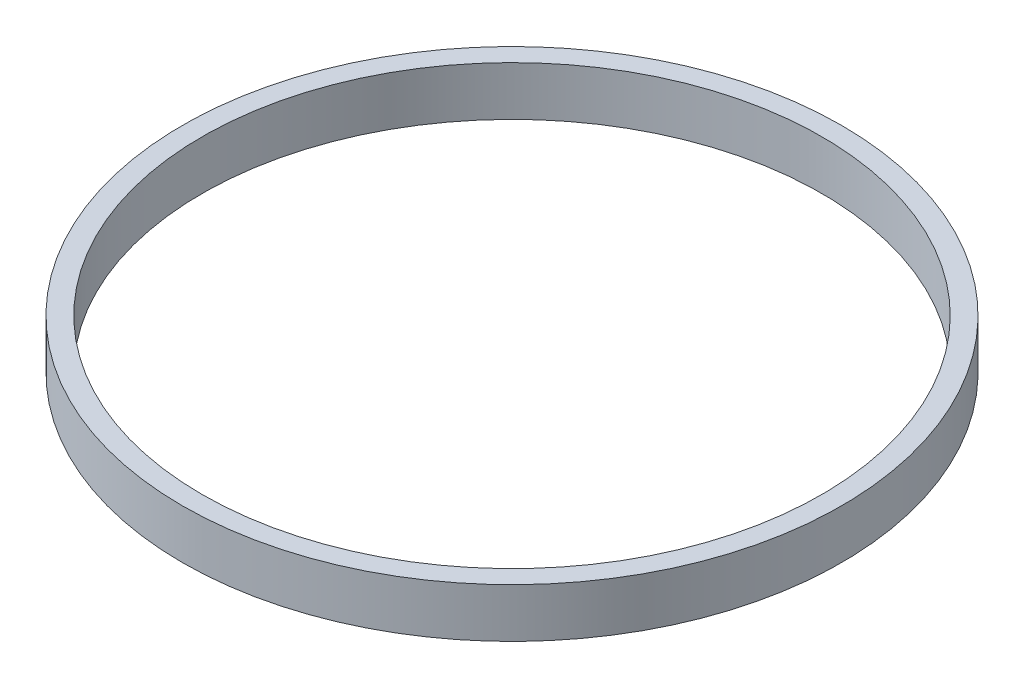
from build123d import *

# Parameters (mm, degrees)
SKETCH1_R           = 33.5
SKETCH1_R_2         = 31.5
BOSS_EXTRUDE1_DEPTH = 5


with BuildPart() as part:
    # Sketch1 → Boss-Extrude1 (new body)
    with BuildSketch(Plane(origin=(0, 0, 0), x_dir=(1, 0, 0), z_dir=(0, 1, 0))):
        with Locations(Location((0, 0, 0), (0, 0, 270))):
            Circle(SKETCH1_R)
        with Locations(Location((0, 0, 0), (0, 0, 270))):
            Circle(SKETCH1_R_2, mode=Mode.SUBTRACT)
    extrude(amount=BOSS_EXTRUDE1_DEPTH)


solid = part.part
